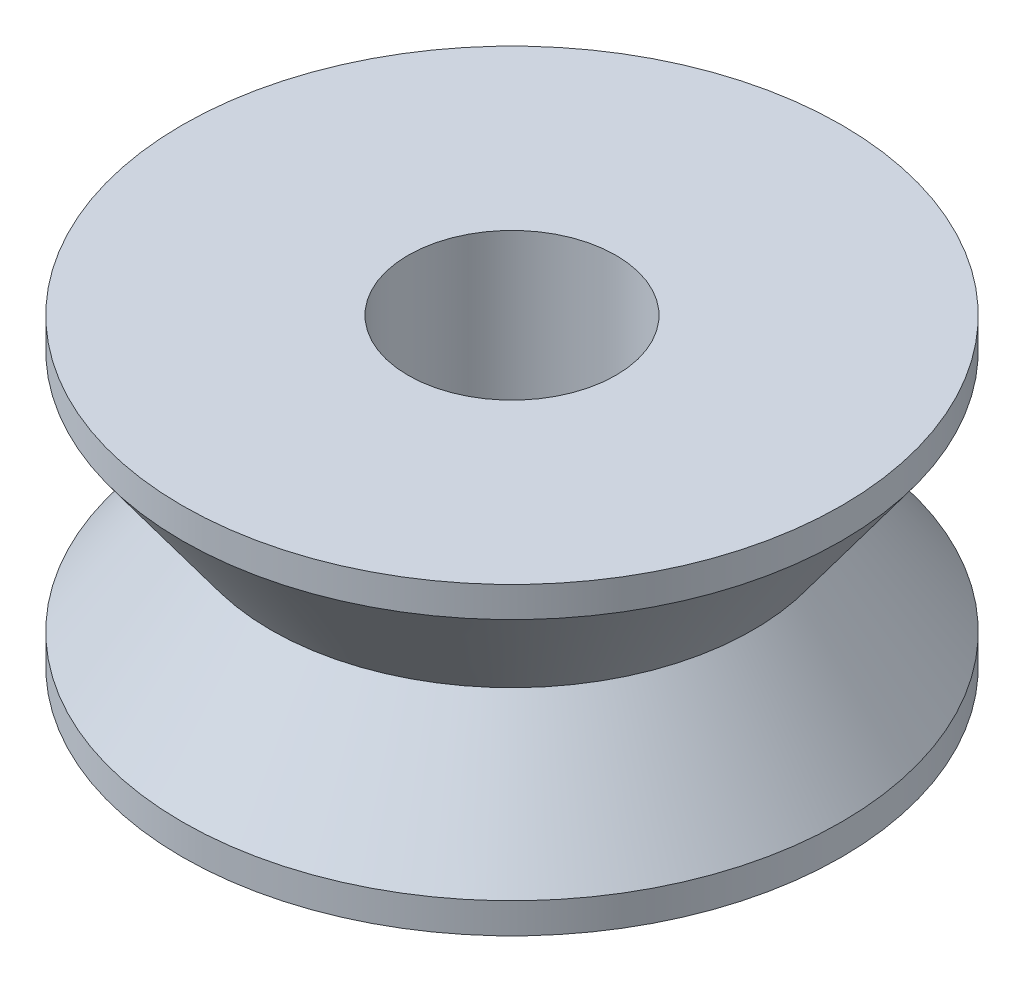
from build123d import *

# Parameters (mm, degrees)
CUT_EXTRUDE1_REACH = 12.977
SKETCH2_R          = 2.05


with BuildPart() as part:
    # Sketch1 → Revolve1 (revolve)
    with BuildSketch(Plane.XY, mode=Mode.PRIVATE) as revolve1_sk:
        Polygon((0, 6), (6.5, 6), (6.5, 5.4), (4.75, 3), (6.5, 0.6), (6.5, 0), (0, 0), align=None)
    revolve(revolve1_sk.sketch.rotate(Axis((0, 0, 0), (0, 1, 0)), 90), axis=Axis((0, 0, 0), (0, 1, 0)))

    # Sketch2 → Cut-Extrude1 (cut, up to next)
    with BuildSketch(Plane(origin=(0, 6, 0), x_dir=(1, 0, 0), z_dir=(0, 1, 0)), mode=Mode.PRIVATE) as cut_extrude1_sk1:
        with Locations(Location((0, 0, 0), (0, 0, 270))):
            Circle(SKETCH2_R)
    cut_extrude1_tool1 = extrude(cut_extrude1_sk1.sketch, amount=-CUT_EXTRUDE1_REACH, mode=Mode.PRIVATE) & part.part
    add(cut_extrude1_tool1.solids().sort_by_distance((0, 6, 0))[0], mode=Mode.SUBTRACT)


solid = part.part
